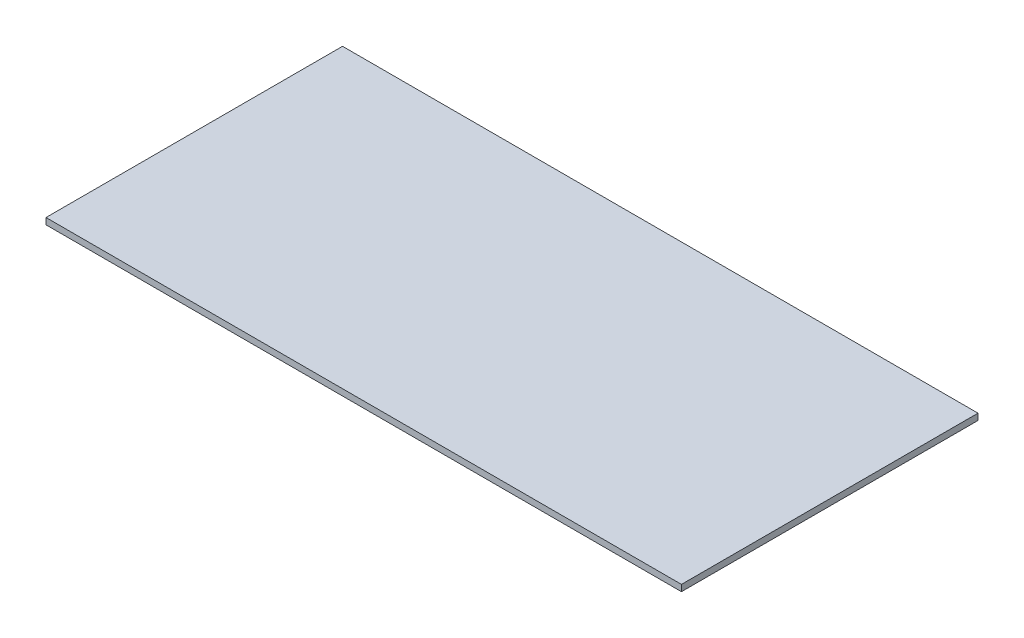
from build123d import *

# Parameters (mm, degrees)
CROQUIS2_W              = 600
CROQUIS2_H              = 280
SALIENTE_EXTRUIR1_DEPTH = 6


with BuildPart() as part:
    # Croquis2 → Saliente-Extruir1 (new body)
    with BuildSketch(Plane(origin=(0, 0, 0), x_dir=(1, 0, 0), z_dir=(0, 1, 0))):
        Rectangle(CROQUIS2_W, CROQUIS2_H)
    extrude(amount=SALIENTE_EXTRUIR1_DEPTH)


solid = part.part
